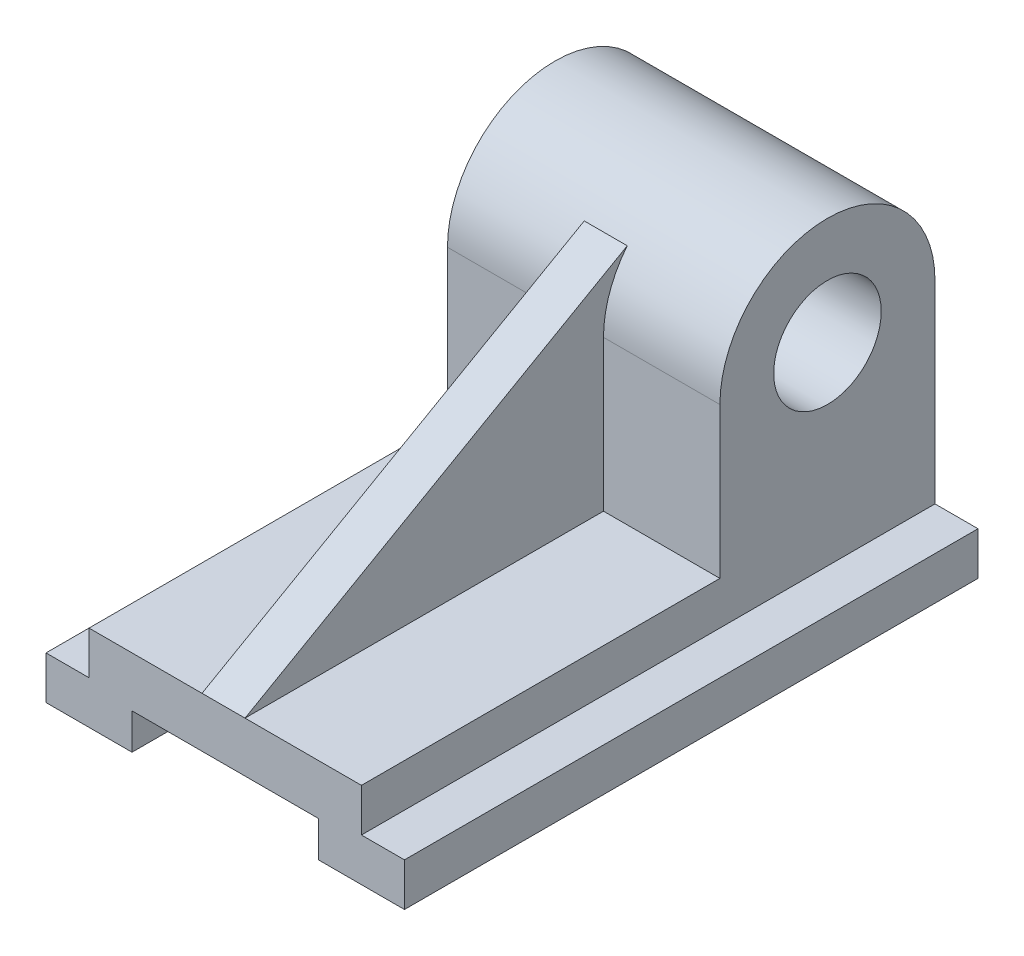
from build123d import *

# Parameters (mm, degrees)
BOSS_EXTRUDE1_DEPTH = 160
SKETCH2_R           = 15
BOSS_EXTRUDE2_DEPTH = 76
BOSS_EXTRUDE3_DEPTH = 12


with BuildPart() as part:
    # Sketch1 → Boss-Extrude1 (new body)
    with BuildSketch(Plane.XY):
        Polygon((-43.521594684, 12), (-43.521594684, 0), (-19.521594684, 0), (-19.521594684, 10), (32.478405316, 10), (32.478405316, 0), (56.478405316, 0), (56.478405316, 12), (44.478405316, 12), (44.478405316, 24), (-31.521594684, 24), (-31.521594684, 12), align=None)
    extrude(amount=-BOSS_EXTRUDE1_DEPTH)

    # Sketch2 → Boss-Extrude2 (add)
    with BuildSketch(Plane(origin=(44.478405316, 0, 0), x_dir=(0, 0, -1), z_dir=(1, 0, 0))):
        with BuildLine():
            Line((100, 24), (160, 24))
            Line((160, 24), (160, 66))
            ThreePointArc((160, 66), (130, 96), (100, 66))
            Line((100, 66), (100, 24))
        make_face()
        with Locations((130, 66)):
            Circle(SKETCH2_R, mode=Mode.SUBTRACT)
    extrude(amount=-BOSS_EXTRUDE2_DEPTH)

    # Sketch8 → Boss-Extrude3 (add)
    with BuildSketch(Plane(origin=(0, 0, 0), x_dir=(0, 0, -1), z_dir=(1, 0, 0))):
        Polygon((0, 24), (109.656121138, 86.535715549), (109.656121138, 24), align=None)
    extrude(amount=BOSS_EXTRUDE3_DEPTH)


solid = part.part
